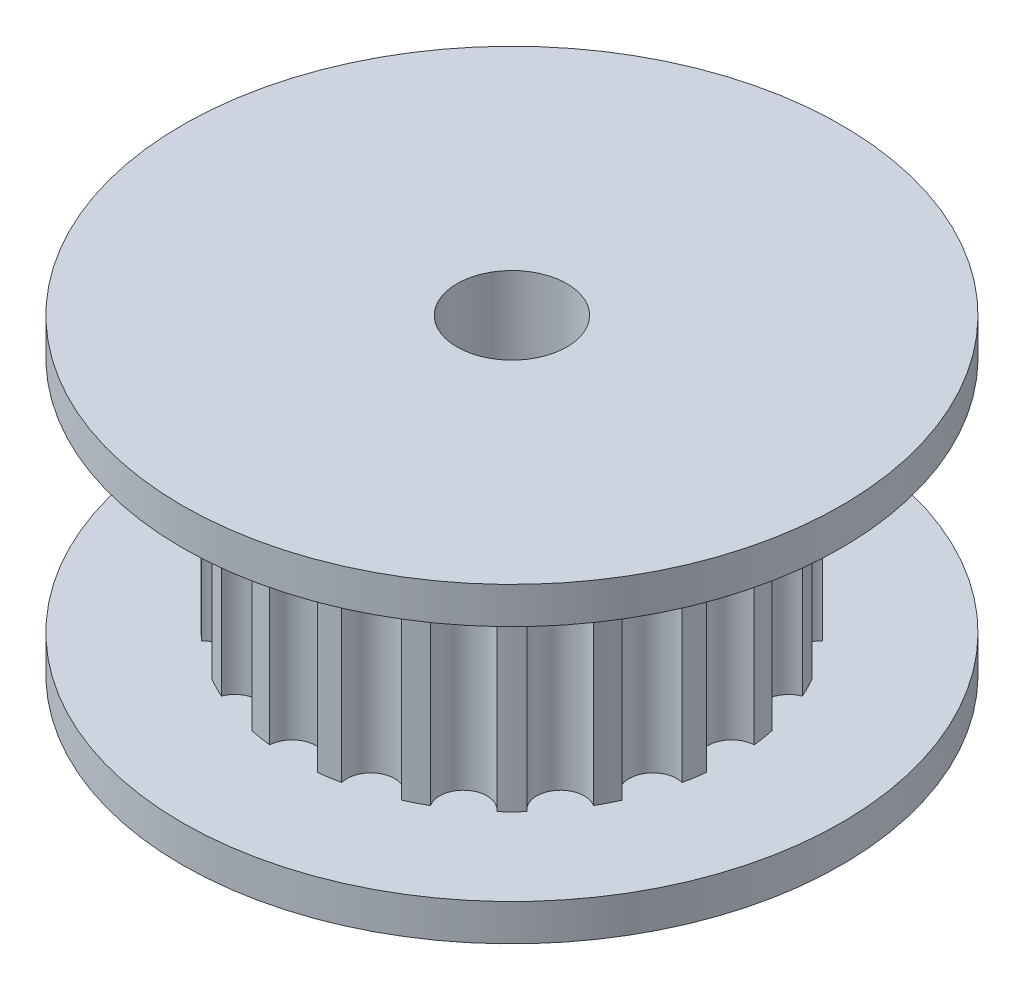
from build123d import *

# Parameters (mm, degrees)
SKETCH_1_R          = 9
EXTRUDE_1_DEPTH     = 1
SKETCH_2_R          = 6
EXTRUDE_2_DEPTH     = 6.5
SKETCH_3_R          = 0.65
CUT_EXTRUDE_1_DEPTH = 6.5
SKETCH_5_R          = 9
EXTRUDE_3_DEPTH     = 1
SKETCH_6_R          = 1.5
CUT_EXTRUDE_2_DEPTH = 16.305227865


with BuildPart() as part:
    # 草图1 → 凸台-拉伸1 (new body)
    with BuildSketch(Plane(origin=(0, 0, 0), x_dir=(1, 0, 0), z_dir=(0, 1, 0))):
        with Locations(Location((0, 0, 0), (0, 0, 270))):
            Circle(SKETCH_1_R)
    extrude(amount=EXTRUDE_1_DEPTH)

    # 草图2 → 凸台-拉伸2 (add)
    with BuildSketch(Plane(origin=(0, 1, 0), x_dir=(1, 0, 0), z_dir=(0, 1, 0))):
        with Locations(Location((0, 0, 0), (0, 0, 90))):
            Circle(SKETCH_2_R)
    extrude(amount=EXTRUDE_2_DEPTH)

    # 草图3 → 切除-拉伸1 (cut)
    with BuildSketch(Plane(origin=(0, 7.5, 0), x_dir=(1, 0, 0), z_dir=(0, 1, 0))):
        with Locations((0, 6)):
            Circle(SKETCH_3_R)
        with Locations((1.854101966, 5.706339098)):
            Circle(SKETCH_3_R)
        with Locations((3.526711514, 4.854101966)):
            Circle(SKETCH_3_R)
        with Locations((4.854101966, 3.526711514)):
            Circle(SKETCH_3_R)
        with Locations((5.706339098, 1.854101966)):
            Circle(SKETCH_3_R)
        with Locations((6, 0)):
            Circle(SKETCH_3_R)
        with Locations((5.706339098, -1.854101966)):
            Circle(SKETCH_3_R)
        with Locations((4.854101966, -3.526711514)):
            Circle(SKETCH_3_R)
        with Locations((3.526711514, -4.854101966)):
            Circle(SKETCH_3_R)
        with Locations((1.854101966, -5.706339098)):
            Circle(SKETCH_3_R)
        with Locations((0, -6)):
            Circle(SKETCH_3_R)
        with Locations((-1.854101966, -5.706339098)):
            Circle(SKETCH_3_R)
        with Locations((-3.526711514, -4.854101966)):
            Circle(SKETCH_3_R)
        with Locations((-4.854101966, -3.526711514)):
            Circle(SKETCH_3_R)
        with Locations((-5.706339098, -1.854101966)):
            Circle(SKETCH_3_R)
        with Locations((-6, 0)):
            Circle(SKETCH_3_R)
        with Locations((-5.706339098, 1.854101966)):
            Circle(SKETCH_3_R)
        with Locations((-4.854101966, 3.526711514)):
            Circle(SKETCH_3_R)
        with Locations((-3.526711514, 4.854101966)):
            Circle(SKETCH_3_R)
        with Locations((-1.854101966, 5.706339098)):
            Circle(SKETCH_3_R)
    extrude(amount=-CUT_EXTRUDE_1_DEPTH, mode=Mode.SUBTRACT)

    # 草图5 → 凸台-拉伸3 (add)
    with BuildSketch(Plane(origin=(0, 7.5, 0), x_dir=(1, 0, 0), z_dir=(0, 1, 0))):
        with Locations(Location((0, 0, 0), (0, 0, 270))):
            Circle(SKETCH_5_R)
    extrude(amount=EXTRUDE_3_DEPTH)

    # 草图6 → 切除-拉伸2 (cut, through all)
    with BuildSketch(Plane(origin=(0, 8.5, 0), x_dir=(1, 0, 0), z_dir=(0, 1, 0))):
        with Locations(Location((0, 0, 0), (0, 0, 270))):
            Circle(SKETCH_6_R)
    extrude(amount=-CUT_EXTRUDE_2_DEPTH, mode=Mode.SUBTRACT)


solid = part.part
